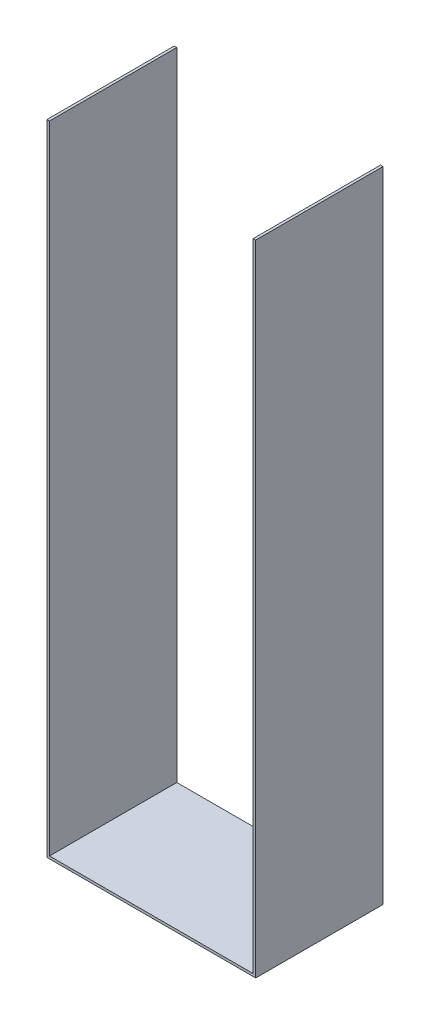
from build123d import *

# Parameters (mm, degrees)
BOSS_EXTRUDE1_DEPTH = 10000


with BuildPart() as part:
    # Sketch2 → Boss-Extrude1 (new body)
    with BuildSketch(Plane.XY):
        Polygon((0, 0), (0, -50000), (16000, -50000), (16000, 0), (16200, 0), (16200, -50200), (-200, -50200), (-200, 0), align=None)
    extrude(amount=-BOSS_EXTRUDE1_DEPTH)


solid = part.part
